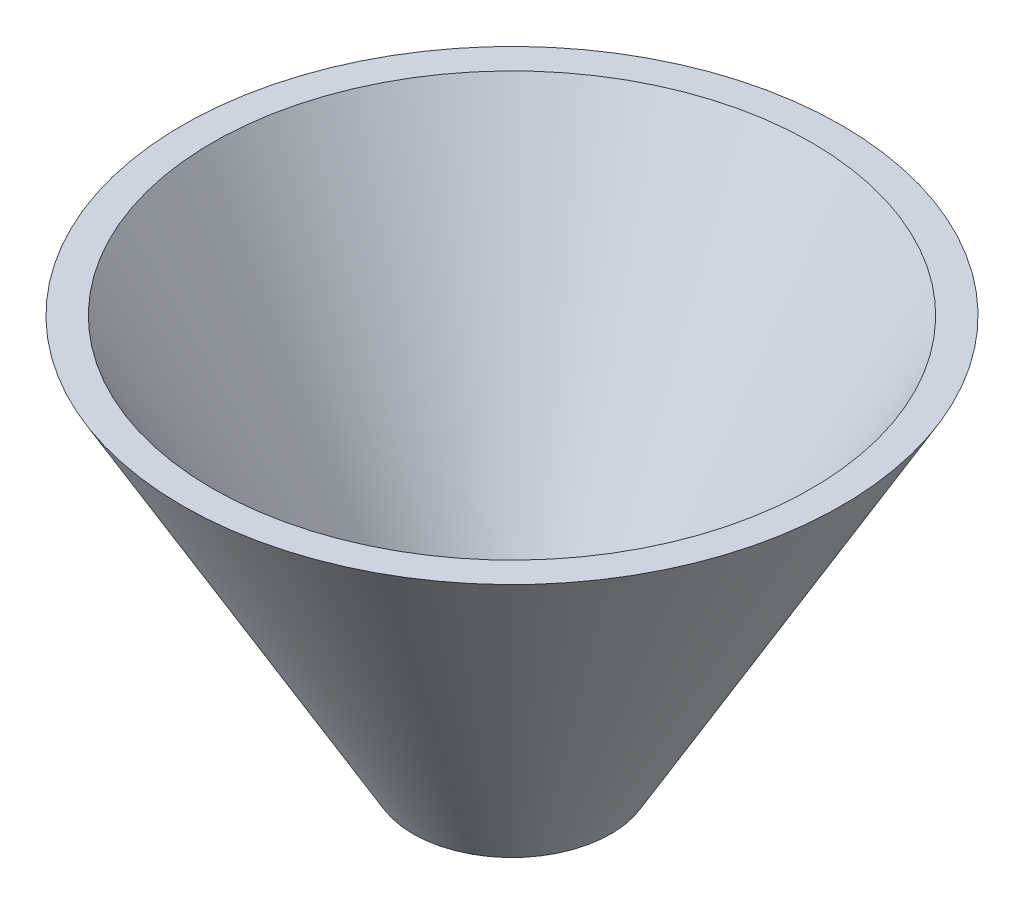
from build123d import *


with BuildPart() as part:
    # 草图1 → 旋转1 (revolve)
    with BuildSketch(Plane.XY, mode=Mode.PRIVATE) as revolve_1_sk:
        Polygon((0, 0), (4.95, 0), (16.497005384, 20), (0, 20), align=None)
    revolve(revolve_1_sk.sketch.rotate(Axis((0, 0, 0), (0, 1, 0)), 270), axis=Axis((0, 0, 0), (0, 1, 0)))

    # 草图2 → 切除-旋转1 (revolve, cut)
    with BuildSketch(Plane.XY, mode=Mode.PRIVATE) as cut_revolve_1_sk:
        Polygon((0, 0), (3.45, 0), (14.997005384, 20), (0, 20), align=None)
    revolve(cut_revolve_1_sk.sketch.rotate(Axis((0, 0, 0), (0, 1, 0)), 270), axis=Axis((0, 0, 0), (0, 1, 0)), mode=Mode.SUBTRACT)


solid = part.part
